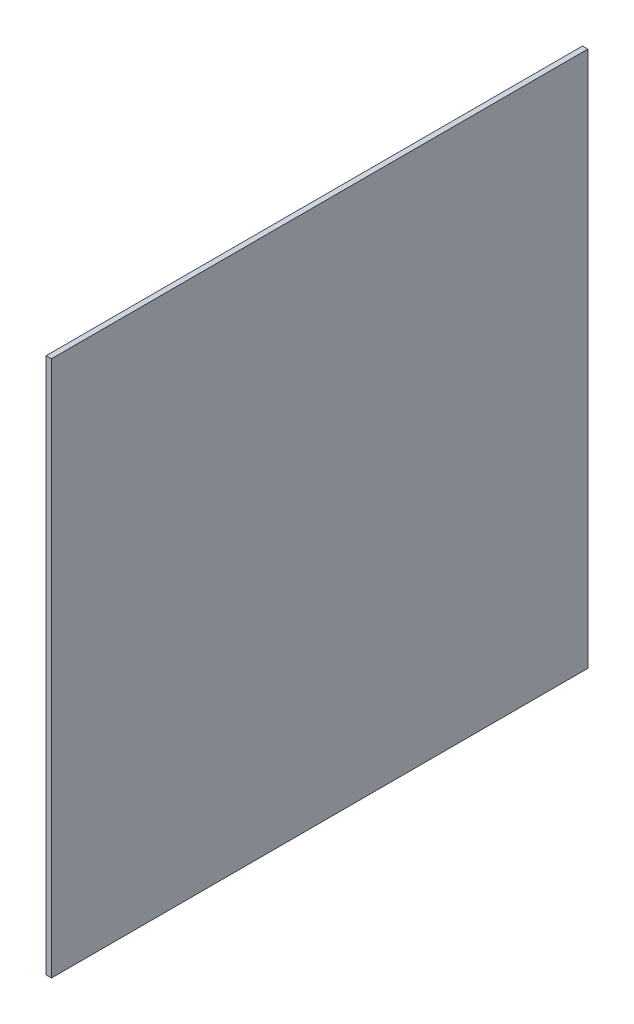
from build123d import *

# Parameters (mm, degrees)
SKETCH2_W           = 300
SKETCH2_H           = 300
BOSS_EXTRUDE1_DEPTH = 3


with BuildPart() as part:
    # Sketch2 → Boss-Extrude1 (new body)
    with BuildSketch(Plane(origin=(0, 0, 0), x_dir=(0, 0, -1), z_dir=(1, 0, 0))):
        Rectangle(SKETCH2_W, SKETCH2_H)
    extrude(amount=BOSS_EXTRUDE1_DEPTH)


solid = part.part
